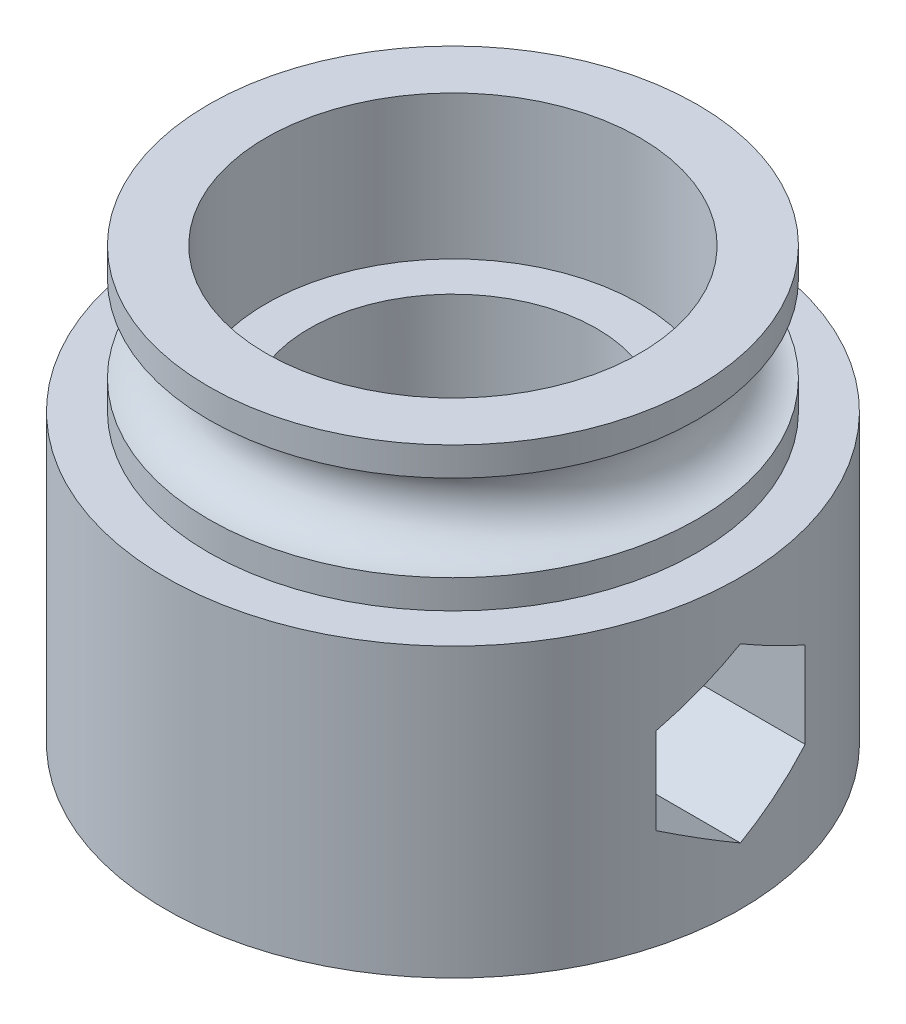
from build123d import *

# Parameters (mm, degrees)
CUT_EXTRUDE1_DEPTH      = 53.363441445
CUT_EXTRUDE1_DEPTH_BACK = 53.363441445


with BuildPart() as part:
    # Sketch1 → Revolve1 (revolve)
    with BuildSketch(Plane.XY, mode=Mode.PRIVATE) as revolve1_sk:
        with BuildLine():
            Line((12.7, 0), (12.7, 25.4))
            Line((12.7, 25.4), (16.51, 25.4))
            Line((16.51, 25.4), (16.51, 38.1))
            Line((16.51, 38.1), (21.59, 38.1))
            Line((21.59, 38.1), (21.59, 35.56))
            ThreePointArc((21.59, 35.56), (17.78, 31.75), (21.59, 27.94))
            Line((21.59, 27.94), (21.59, 25.4))
            Line((21.59, 25.4), (25.4, 25.4))
            Line((25.4, 25.4), (25.4, 0))
            Line((25.4, 0), (12.7, 0))
        make_face()
    revolve(revolve1_sk.sketch.rotate(Axis((0, 0, 0), (0, 1, 0)), 90), axis=Axis((0, 0, 0), (0, 1, 0)))

    # Sketch2 → Cut-Extrude1 (cut, two sides: drawn at the far end of the back side and taken through both)
    with BuildSketch(Plane(origin=(0, 0, 0), x_dir=(0, 0, -1), z_dir=(1, 0, 0)).offset(-CUT_EXTRUDE1_DEPTH_BACK)):
        Polygon((0, 20.32), (-6.599113577, 16.51), (-6.599113577, 8.89), (0, 5.08), (6.599113577, 8.89), (6.599113577, 16.51), align=None)
    extrude(amount=CUT_EXTRUDE1_DEPTH + CUT_EXTRUDE1_DEPTH_BACK, mode=Mode.SUBTRACT)


solid = part.part
